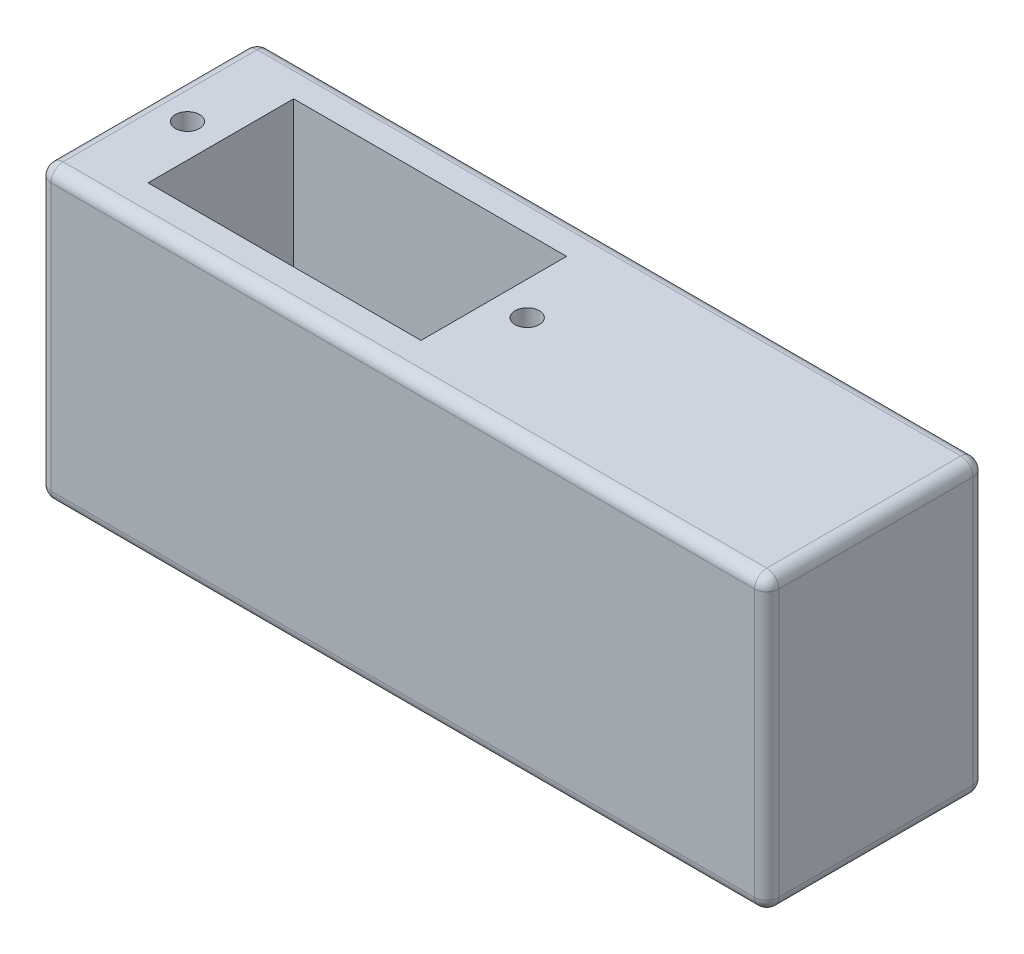
from build123d import *

# Parameters (mm, degrees)
SKETCH_1_W          = 60
SKETCH_1_H          = 18
SKETCH_1_W_2        = 22.5
SKETCH_1_H_2        = 12
EXTRUDE_1_DEPTH     = 21
SKETCH_2_W          = 60
SKETCH_2_H          = 18
EXTRUDE_2_DEPTH     = 3
SKETCH_3_W          = 6
SKETCH_3_H          = 3
CUT_EXTRUDE_1_DEPTH = 6
SKETCH_4_R          = 2.75
EXTRUDE_3_DEPTH     = 5
SKETCH_6_R          = 1
CUT_EXTRUDE_2_DEPTH = 5
FILLET_1_R          = 1


with BuildPart() as part:
    # 草图1 → 凸台-拉伸1 (new body)
    with BuildSketch(Plane(origin=(0, 0, 0), x_dir=(1, 0, 0), z_dir=(0, 1, 0))):
        Rectangle(SKETCH_1_W, SKETCH_1_H)
        with Locations((-12.75, 0)):
            Rectangle(SKETCH_1_W_2, SKETCH_1_H_2, mode=Mode.SUBTRACT)
    extrude(amount=EXTRUDE_1_DEPTH)

    # 草图2 → 凸台-拉伸2 (add)
    with BuildSketch(Plane.XZ):
        Rectangle(SKETCH_2_W, SKETCH_2_H)
    extrude(amount=EXTRUDE_2_DEPTH)

    # 草图3 → 切除-拉伸1 (cut)
    with BuildSketch(Plane.ZY.offset(30)):
        with Locations((0, 1.5)):
            Rectangle(SKETCH_3_W, SKETCH_3_H)
    extrude(amount=-CUT_EXTRUDE_1_DEPTH, mode=Mode.SUBTRACT)

    # 草图4 → 凸台-拉伸3 (add)
    with BuildSketch(Plane.XZ.offset(3)):
        with Locations(Location((-18, 0, 0), (0, 0, 270))):
            Circle(SKETCH_4_R)
    extrude(amount=EXTRUDE_3_DEPTH)

    # 草图6 → 切除-拉伸2 (cut)
    with BuildSketch(Plane(origin=(0, 21, 0), x_dir=(1, 0, 0), z_dir=(0, 1, 0))):
        with Locations(Location((-26.75, 0, 0), (0, 0, 270))):
            Circle(SKETCH_6_R)
        with Locations(Location((1.25, 0, 0), (0, 0, 270))):
            Circle(SKETCH_6_R)
    extrude(amount=-CUT_EXTRUDE_2_DEPTH, mode=Mode.SUBTRACT)

    # 圆角1
    fillet_1_edges = [part.edges().sort_by_distance(p)[0] for p in [
        (-30, 21, 0),
        (0, 21, 9),
        (-30, -3, 0),
        (0, -3, -9),
        (30, -3, 0),
        (0, -3, 9),
        (30, 21, 0),
        (-30, 1.5, -3),
        (-30, 0, 0),
        (-30, 1.5, 3),
        (-30, 3, 0),
        (-18, -3, 2.75),
        (0, 21, -9),
        (30, 9, 9),
        (-30, 9, 9),
        (-30, 9, -9),
        (30, 9, -9),
    ]]
    fillet(fillet_1_edges, radius=FILLET_1_R)


solid = part.part
